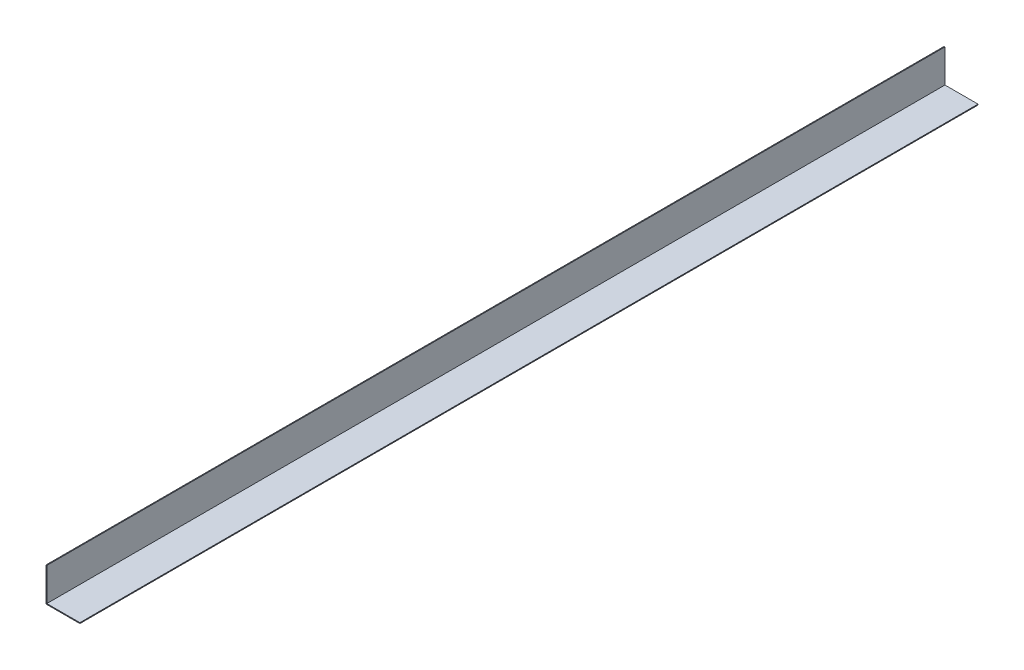
from build123d import *

# Parameters (mm, degrees)
SUPERFICIE_EXTRUIR1_1_DEPTH = 1060
DAR_ESPESOR1_T2             = 1


with BuildPart() as body_1:
    # Superficie-Extruir1: a surface, the sketch's curves swept straight by 1060 mm
    with BuildLine(Plane.XY, mode=Mode.PRIVATE) as superficie_extruir1_1_path:
        Line((0, 0), (-40, 0))
        Line((-40, 0), (-40, 40))
    superficie_extruir1_1 = Shell.extrude(superficie_extruir1_1_path.wire(), (0 * SUPERFICIE_EXTRUIR1_1_DEPTH, 0 * SUPERFICIE_EXTRUIR1_1_DEPTH, 1 * SUPERFICIE_EXTRUIR1_1_DEPTH))
    add(Solid.thicken(superficie_extruir1_1, -DAR_ESPESOR1_T2))


solid = body_1.part
